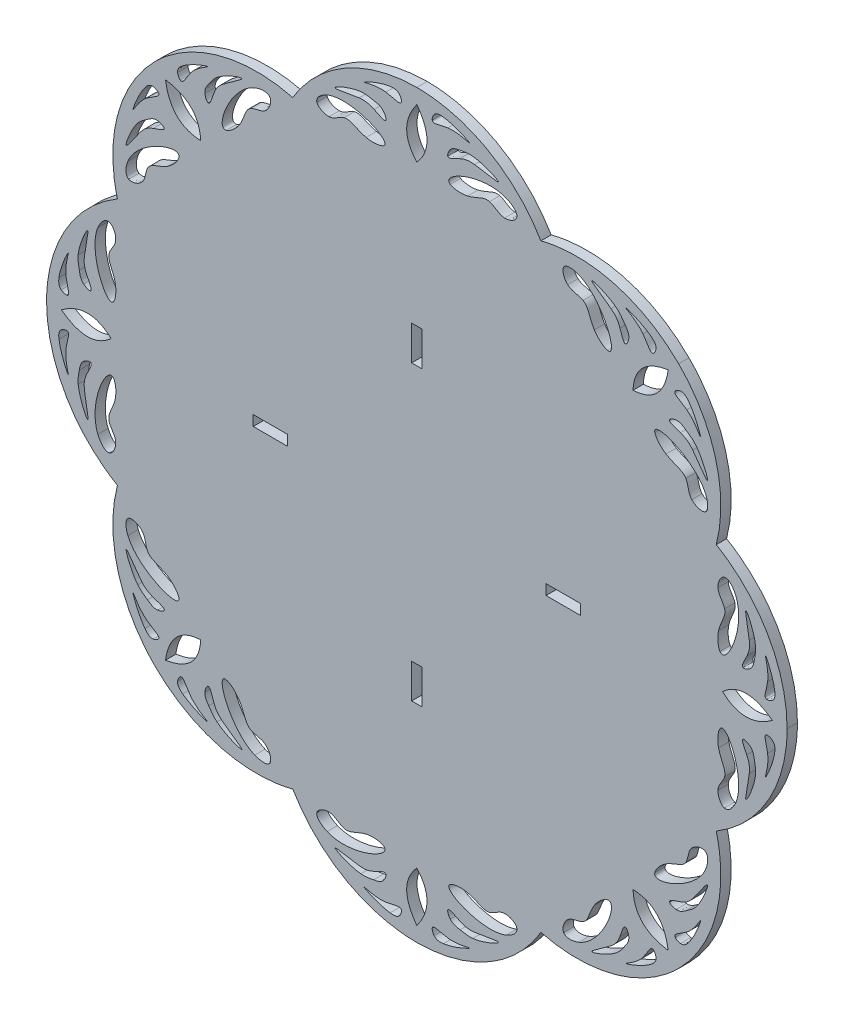
from build123d import *

# Parameters (mm, degrees)
MODEL_W                  = 6.6666
MODEL_H                  = 2
MODEL_W_2                = 2
MODEL_H_2                = 6.6667
MODEL_W_3                = 6.6667
RESSALTO_EXTRUS_O1_DEPTH = 2


with BuildPart() as part:
    # Model → Ressalto-extrusão1 (new body)
    with BuildSketch(Plane.XY):
        with BuildLine():
            add(Edge.make_bspline(
                [(57.9547, 37.0512), (66.4517, 42.0625), (71.6666, 51.1922), (71.6667, 61.0569)],
                knots=[0.055555556, 0.055555556, 0.055555556, 0.055555556, 0.111111111, 0.111111111, 0.111111111, 0.111111111], degree=3))
            add(Edge.make_bspline(
                [(71.6667, 61.0569), (71.6667, 70.9215), (66.4518, 80.0512), (57.9546, 85.0625)],
                knots=[0.111111111, 0.111111111, 0.111111111, 0.111111111, 0.166666667, 0.166666667, 0.166666667, 0.166666667], degree=3))
            add(Edge.make_bspline(
                [(57.9546, 85.0625), (60.4196, 94.6143), (57.6514, 104.7574), (50.6761, 111.7329)],
                knots=[0.166666667, 0.166666667, 0.166666667, 0.166666667, 0.222222222, 0.222222222, 0.222222222, 0.222222222], degree=3))
            add(Edge.make_bspline(
                [(50.6761, 111.7329), (43.7007, 118.7082), (33.5575, 121.4765), (24.0057, 119.0116)],
                knots=[0.222222222, 0.222222222, 0.222222222, 0.222222222, 0.277777778, 0.277777778, 0.277777778, 0.277777778], degree=3))
            add(Edge.make_bspline(
                [(24.0057, 119.0116), (18.9945, 127.5087), (9.8648, 132.7236), (0.0001, 132.7236)],
                knots=[0.277777778, 0.277777778, 0.277777778, 0.277777778, 0.333333333, 0.333333333, 0.333333333, 0.333333333], degree=3))
            add(Edge.make_bspline(
                [(0.0001, 132.7236), (-9.8647, 132.7236), (-18.9944, 127.5087), (-24.0056, 119.0116)],
                knots=[0.333333333, 0.333333333, 0.333333333, 0.333333333, 0.388888889, 0.388888889, 0.388888889, 0.388888889], degree=3))
            add(Edge.make_bspline(
                [(-24.0056, 119.0116), (-33.5573, 121.4765), (-43.7005, 118.7083), (-50.6759, 111.7329)],
                knots=[0.388888889, 0.388888889, 0.388888889, 0.388888889, 0.444444444, 0.444444444, 0.444444444, 0.444444444], degree=3))
            add(Edge.make_bspline(
                [(-50.6759, 111.7329), (-57.6513, 104.7575), (-60.4195, 94.6143), (-57.9546, 85.0625)],
                knots=[0.444444444, 0.444444444, 0.444444444, 0.444444444, 0.5, 0.5, 0.5, 0.5], degree=3))
            add(Edge.make_bspline(
                [(-57.9546, 85.0625), (-66.4517, 80.0514), (-71.6666, 70.9216), (-71.6666, 61.0569)],
                knots=[0.5, 0.5, 0.5, 0.5, 0.555555556, 0.555555556, 0.555555556, 0.555555556], degree=3))
            add(Edge.make_bspline(
                [(-71.6666, 61.0569), (-71.6666, 51.1922), (-66.4517, 42.0625), (-57.9546, 37.0513)],
                knots=[0.555555556, 0.555555556, 0.555555556, 0.555555556, 0.611111111, 0.611111111, 0.611111111, 0.611111111], degree=3))
            add(Edge.make_bspline(
                [(-57.9546, 37.0513), (-60.4195, 27.4996), (-57.6513, 17.3563), (-50.6759, 10.3809)],
                knots=[0.611111111, 0.611111111, 0.611111111, 0.611111111, 0.666666667, 0.666666667, 0.666666667, 0.666666667], degree=3))
            add(Edge.make_bspline(
                [(-50.6759, 10.3809), (-43.7005, 3.4056), (-33.5573, 0.6374), (-24.0056, 3.1023)],
                knots=[0.666666667, 0.666666667, 0.666666667, 0.666666667, 0.722222222, 0.722222222, 0.722222222, 0.722222222], degree=3))
            add(Edge.make_bspline(
                [(-24.0056, 3.1023), (-18.9944, -5.3948), (-9.8647, -10.6097), (0.0001, -10.6097)],
                knots=[0.722222222, 0.722222222, 0.722222222, 0.722222222, 0.777777778, 0.777777778, 0.777777778, 0.777777778], degree=3))
            add(Edge.make_bspline(
                [(0.0001, -10.6097), (9.8648, -10.6097), (18.9945, -5.3948), (24.0057, 3.1023)],
                knots=[0.777777778, 0.777777778, 0.777777778, 0.777777778, 0.833333333, 0.833333333, 0.833333333, 0.833333333], degree=3))
            add(Edge.make_bspline(
                [(24.0057, 3.1023), (33.5574, 0.6374), (43.7006, 3.4056), (50.676, 10.3809)],
                knots=[0.833333333, 0.833333333, 0.833333333, 0.833333333, 0.888888889, 0.888888889, 0.888888889, 0.888888889], degree=3))
            add(Edge.make_bspline(
                [(50.676, 10.3809), (57.6513, 17.3563), (60.4196, 27.4994), (57.9547, 37.0512)],
                knots=[0.888888889, 0.888888889, 0.888888889, 0.888888889, 1, 1, 1, 1], degree=3))
        make_face()
        with Locations((28.3334, 61.0569)):
            Rectangle(MODEL_W, MODEL_H, mode=Mode.SUBTRACT)
        with Locations((0.0001, 89.39025)):
            Rectangle(MODEL_W_2, MODEL_H_2, mode=Mode.SUBTRACT)
        with Locations((-28.33325, 61.0569)):
            Rectangle(MODEL_W_3, MODEL_H, mode=Mode.SUBTRACT)
        with Locations((0.0001, 32.72365)):
            Rectangle(MODEL_W_2, MODEL_H_2, mode=Mode.SUBTRACT)
        with BuildLine():
            add(Edge.make_bspline(
                [(-52.2509, 104.8151), (-51.0841, 105.7149), (-49.5495, 106.2377), (-50.0038, 106.8337)],
                knots=[0, 0, 0, 0, 0.166666667, 0.166666667, 0.166666667, 0.166666667], degree=3))
            add(Edge.make_bspline(
                [(-50.0038, 106.8337), (-50.1747, 107.0579), (-50.6271, 107.2925), (-51.0214, 107.3395)],
                knots=[0.166666667, 0.166666667, 0.166666667, 0.166666667, 0.333333333, 0.333333333, 0.333333333, 0.333333333], degree=3))
            add(Edge.make_bspline(
                [(-51.0214, 107.3395), (-51.675, 107.4175), (-52.1689, 106.9805), (-52.6361, 106.3699)],
                knots=[0.333333333, 0.333333333, 0.333333333, 0.333333333, 0.5, 0.5, 0.5, 0.5], degree=3))
            add(Edge.make_bspline(
                [(-52.6361, 106.3699), (-53.9612, 104.6382), (-55.0714, 101.5111), (-54.917, 101.5396)],
                knots=[0.5, 0.5, 0.5, 0.5, 0.666666667, 0.666666667, 0.666666667, 0.666666667], degree=3))
            add(Edge.make_bspline(
                [(-54.917, 101.5396), (-54.795, 101.5621), (-53.8823, 103.557), (-52.2509, 104.8151)],
                knots=[0.666666667, 0.666666667, 0.666666667, 0.666666667, 1, 1, 1, 1], degree=3))
        make_face(mode=Mode.SUBTRACT)
        with BuildLine():
            add(Edge.make_bspline(
                [(-52.0754, 93.2206), (-51.4239, 94.3293), (-49.6775, 94.4625), (-48.2286, 95.3916)],
                knots=[0, 0, 0, 0, 0.142857143, 0.142857143, 0.142857143, 0.142857143], degree=3))
            add(Edge.make_bspline(
                [(-48.2286, 95.3916), (-47.1296, 96.0963), (-46.2019, 97.2589), (-46.0576, 97.9434)],
                knots=[0.142857143, 0.142857143, 0.142857143, 0.142857143, 0.285714286, 0.285714286, 0.285714286, 0.285714286], degree=3))
            add(Edge.make_bspline(
                [(-46.0576, 97.9434), (-45.5709, 100.253), (-54.0055, 97.1175), (-55.9222, 92.4208)],
                knots=[0.285714286, 0.285714286, 0.285714286, 0.285714286, 0.428571429, 0.428571429, 0.428571429, 0.428571429], degree=3))
            add(Edge.make_bspline(
                [(-55.9222, 92.4208), (-56.4254, 91.1875), (-56.4794, 89.8466), (-55.7668, 89.4564)],
                knots=[0.428571429, 0.428571429, 0.428571429, 0.428571429, 0.571428571, 0.571428571, 0.571428571, 0.571428571], degree=3))
            add(Edge.make_bspline(
                [(-55.7668, 89.4564), (-55.1261, 89.1054), (-53.8656, 89.5232), (-53.218, 90.2498)],
                knots=[0.571428571, 0.571428571, 0.571428571, 0.571428571, 0.714285714, 0.714285714, 0.714285714, 0.714285714], degree=3))
            add(Edge.make_bspline(
                [(-53.218, 90.2498), (-52.4458, 91.1162), (-52.5449, 92.4217), (-52.0754, 93.2206)],
                knots=[0.714285714, 0.714285714, 0.714285714, 0.714285714, 1, 1, 1, 1], degree=3))
        make_face(mode=Mode.SUBTRACT)
        with BuildLine():
            add(Edge.make_bspline(
                [(-32.1751, 113.1209), (-31.3762, 113.5904), (-30.0707, 113.4913), (-29.2043, 114.2635)],
                knots=[0, 0, 0, 0, 0.142857143, 0.142857143, 0.142857143, 0.142857143], degree=3))
            add(Edge.make_bspline(
                [(-29.2043, 114.2635), (-28.4777, 114.9111), (-28.0598, 116.1716), (-28.4109, 116.8123)],
                knots=[0.142857143, 0.142857143, 0.142857143, 0.142857143, 0.285714286, 0.285714286, 0.285714286, 0.285714286], degree=3))
            add(Edge.make_bspline(
                [(-28.4109, 116.8123), (-28.8011, 117.5248), (-30.142, 117.4709), (-31.3753, 116.9677)],
                knots=[0.285714286, 0.285714286, 0.285714286, 0.285714286, 0.428571429, 0.428571429, 0.428571429, 0.428571429], degree=3))
            add(Edge.make_bspline(
                [(-31.3753, 116.9677), (-36.072, 115.051), (-39.2075, 106.6164), (-36.8979, 107.1032)],
                knots=[0.428571429, 0.428571429, 0.428571429, 0.428571429, 0.571428571, 0.571428571, 0.571428571, 0.571428571], degree=3))
            add(Edge.make_bspline(
                [(-36.8979, 107.1032), (-36.2135, 107.2473), (-35.0508, 108.1751), (-34.3461, 109.2741)],
                knots=[0.571428571, 0.571428571, 0.571428571, 0.571428571, 0.714285714, 0.714285714, 0.714285714, 0.714285714], degree=3))
            add(Edge.make_bspline(
                [(-34.3461, 109.2741), (-33.417, 110.7229), (-33.2838, 112.4693), (-32.1751, 113.1209)],
                knots=[0.714285714, 0.714285714, 0.714285714, 0.714285714, 1, 1, 1, 1], degree=3))
        make_face(mode=Mode.SUBTRACT)
        with BuildLine():
            add(Edge.make_bspline(
                [(-43.7696, 113.2964), (-42.5115, 114.9278), (-40.5165, 115.8405), (-40.4941, 115.9625)],
                knots=[0, 0, 0, 0, 0.166666667, 0.166666667, 0.166666667, 0.166666667], degree=3))
            add(Edge.make_bspline(
                [(-40.4941, 115.9625), (-40.4657, 116.1169), (-43.5927, 115.0068), (-45.3243, 113.6817)],
                knots=[0.166666667, 0.166666667, 0.166666667, 0.166666667, 0.333333333, 0.333333333, 0.333333333, 0.333333333], degree=3))
            add(Edge.make_bspline(
                [(-45.3243, 113.6817), (-45.9349, 113.2144), (-46.372, 112.7205), (-46.2941, 112.0669)],
                knots=[0.333333333, 0.333333333, 0.333333333, 0.333333333, 0.5, 0.5, 0.5, 0.5], degree=3))
            add(Edge.make_bspline(
                [(-46.2941, 112.0669), (-46.247, 111.6726), (-46.0124, 111.2202), (-45.7882, 111.0493)],
                knots=[0.5, 0.5, 0.5, 0.5, 0.666666667, 0.666666667, 0.666666667, 0.666666667], degree=3))
            add(Edge.make_bspline(
                [(-45.7882, 111.0493), (-45.1922, 110.595), (-44.6694, 112.1296), (-43.7696, 113.2964)],
                knots=[0.666666667, 0.666666667, 0.666666667, 0.666666667, 1, 1, 1, 1], degree=3))
        make_face(mode=Mode.SUBTRACT)
        with BuildLine():
            add(Edge.make_bspline(
                [(-65.3251, 52.6691), (-65.4687, 51.8708), (-65.6418, 51.1534), (-65.5495, 50.2005)],
                knots=[0, 0, 0, 0, 0.125, 0.125, 0.125, 0.125], degree=3))
            add(Edge.make_bspline(
                [(-65.5495, 50.2005), (-65.3525, 48.1667), (-63.9461, 45.0602), (-63.6955, 45.2451)],
                knots=[0.125, 0.125, 0.125, 0.125, 0.25, 0.25, 0.25, 0.25], degree=3))
            add(Edge.make_bspline(
                [(-63.6955, 45.2451), (-63.4739, 45.4086), (-64.1556, 48.1441), (-64.3418, 49.8773)],
                knots=[0.25, 0.25, 0.25, 0.25, 0.375, 0.375, 0.375, 0.375], degree=3))
            add(Edge.make_bspline(
                [(-64.3418, 49.8773), (-64.4592, 50.9701), (-64.3797, 51.6644), (-63.857, 52.786)],
                knots=[0.375, 0.375, 0.375, 0.375, 0.5, 0.5, 0.5, 0.5], degree=3))
            add(Edge.make_bspline(
                [(-63.857, 52.786), (-63.4373, 53.6866), (-62.7316, 54.8628), (-63.1568, 55.0482)],
                knots=[0.5, 0.5, 0.5, 0.5, 0.625, 0.625, 0.625, 0.625], degree=3))
            add(Edge.make_bspline(
                [(-63.1568, 55.0482), (-63.4115, 55.1593), (-64.0717, 54.9149), (-64.4915, 54.5685)],
                knots=[0.625, 0.625, 0.625, 0.625, 0.75, 0.75, 0.75, 0.75], degree=3))
            add(Edge.make_bspline(
                [(-64.4915, 54.5685), (-65.1055, 54.062), (-65.205, 53.3372), (-65.3251, 52.6691)],
                knots=[0.75, 0.75, 0.75, 0.75, 1, 1, 1, 1], degree=3))
        make_face(mode=Mode.SUBTRACT)
        with BuildLine():
            add(Edge.make_bspline(
                [(-65.3251, 69.4217), (-65.205, 68.7537), (-65.1055, 68.0289), (-64.4915, 67.5224)],
                knots=[0, 0, 0, 0, 0.125, 0.125, 0.125, 0.125], degree=3))
            add(Edge.make_bspline(
                [(-64.4915, 67.5224), (-64.0717, 67.176), (-63.4115, 66.9316), (-63.1568, 67.0427)],
                knots=[0.125, 0.125, 0.125, 0.125, 0.25, 0.25, 0.25, 0.25], degree=3))
            add(Edge.make_bspline(
                [(-63.1568, 67.0427), (-62.7316, 67.2281), (-63.4373, 68.4042), (-63.857, 69.3049)],
                knots=[0.25, 0.25, 0.25, 0.25, 0.375, 0.375, 0.375, 0.375], degree=3))
            add(Edge.make_bspline(
                [(-63.857, 69.3049), (-64.3797, 70.4264), (-64.4592, 71.1208), (-64.3418, 72.2135)],
                knots=[0.375, 0.375, 0.375, 0.375, 0.5, 0.5, 0.5, 0.5], degree=3))
            add(Edge.make_bspline(
                [(-64.3418, 72.2135), (-64.1556, 73.9468), (-63.4739, 76.6823), (-63.6955, 76.8458)],
                knots=[0.5, 0.5, 0.5, 0.5, 0.625, 0.625, 0.625, 0.625], degree=3))
            add(Edge.make_bspline(
                [(-63.6955, 76.8458), (-63.9461, 77.0307), (-65.3525, 73.9242), (-65.5495, 71.8904)],
                knots=[0.625, 0.625, 0.625, 0.625, 0.75, 0.75, 0.75, 0.75], degree=3))
            add(Edge.make_bspline(
                [(-65.5495, 71.8904), (-65.6418, 70.9375), (-65.4687, 70.2201), (-65.3251, 69.4217)],
                knots=[0.75, 0.75, 0.75, 0.75, 1, 1, 1, 1], degree=3))
        make_face(mode=Mode.SUBTRACT)
        with BuildLine():
            add(Edge.make_bspline(
                [(-43.7696, 8.7945), (-44.6694, 9.9613), (-45.1922, 11.4959), (-45.7882, 11.0416)],
                knots=[0, 0, 0, 0, 0.166666667, 0.166666667, 0.166666667, 0.166666667], degree=3))
            add(Edge.make_bspline(
                [(-45.7882, 11.0416), (-46.0124, 10.8707), (-46.247, 10.4182), (-46.2941, 10.0239)],
                knots=[0.166666667, 0.166666667, 0.166666667, 0.166666667, 0.333333333, 0.333333333, 0.333333333, 0.333333333], degree=3))
            add(Edge.make_bspline(
                [(-46.2941, 10.0239), (-46.372, 9.3704), (-45.9349, 8.8765), (-45.3243, 8.4092)],
                knots=[0.333333333, 0.333333333, 0.333333333, 0.333333333, 0.5, 0.5, 0.5, 0.5], degree=3))
            add(Edge.make_bspline(
                [(-45.3243, 8.4092), (-43.5927, 7.0841), (-40.4657, 5.974), (-40.4941, 6.1284)],
                knots=[0.5, 0.5, 0.5, 0.5, 0.666666667, 0.666666667, 0.666666667, 0.666666667], degree=3))
            add(Edge.make_bspline(
                [(-40.4941, 6.1284), (-40.5165, 6.2504), (-42.5115, 7.163), (-43.7696, 8.7945)],
                knots=[0.666666667, 0.666666667, 0.666666667, 0.666666667, 1, 1, 1, 1], degree=3))
        make_face(mode=Mode.SUBTRACT)
        with BuildLine():
            add(Edge.make_bspline(
                [(-32.1751, 8.97), (-33.2838, 9.6215), (-33.417, 11.368), (-34.3461, 12.8168)],
                knots=[0, 0, 0, 0, 0.142857143, 0.142857143, 0.142857143, 0.142857143], degree=3))
            add(Edge.make_bspline(
                [(-34.3461, 12.8168), (-35.0508, 13.9158), (-36.2135, 14.8436), (-36.8979, 14.9877)],
                knots=[0.142857143, 0.142857143, 0.142857143, 0.142857143, 0.285714286, 0.285714286, 0.285714286, 0.285714286], degree=3))
            add(Edge.make_bspline(
                [(-36.8979, 14.9877), (-39.2075, 15.4745), (-36.072, 7.0399), (-31.3753, 5.1232)],
                knots=[0.285714286, 0.285714286, 0.285714286, 0.285714286, 0.428571429, 0.428571429, 0.428571429, 0.428571429], degree=3))
            add(Edge.make_bspline(
                [(-31.3753, 5.1232), (-30.142, 4.6199), (-28.8011, 4.5661), (-28.4109, 5.2785)],
                knots=[0.428571429, 0.428571429, 0.428571429, 0.428571429, 0.571428571, 0.571428571, 0.571428571, 0.571428571], degree=3))
            add(Edge.make_bspline(
                [(-28.4109, 5.2785), (-28.0598, 5.9193), (-28.4777, 7.1798), (-29.2043, 7.8274)],
                knots=[0.571428571, 0.571428571, 0.571428571, 0.571428571, 0.714285714, 0.714285714, 0.714285714, 0.714285714], degree=3))
            add(Edge.make_bspline(
                [(-29.2043, 7.8274), (-30.0707, 8.5996), (-31.3762, 8.5005), (-32.1751, 8.97)],
                knots=[0.714285714, 0.714285714, 0.714285714, 0.714285714, 1, 1, 1, 1], degree=3))
        make_face(mode=Mode.SUBTRACT)
        with BuildLine():
            add(Edge.make_bspline(
                [(-52.0754, 28.8702), (-52.5449, 29.6692), (-52.4458, 30.9747), (-53.218, 31.8411)],
                knots=[0, 0, 0, 0, 0.142857143, 0.142857143, 0.142857143, 0.142857143], degree=3))
            add(Edge.make_bspline(
                [(-53.218, 31.8411), (-53.8656, 32.5677), (-55.1261, 32.9855), (-55.7668, 32.6345)],
                knots=[0.142857143, 0.142857143, 0.142857143, 0.142857143, 0.285714286, 0.285714286, 0.285714286, 0.285714286], degree=3))
            add(Edge.make_bspline(
                [(-55.7668, 32.6345), (-56.4794, 32.2443), (-56.4254, 30.9034), (-55.9222, 29.6701)],
                knots=[0.285714286, 0.285714286, 0.285714286, 0.285714286, 0.428571429, 0.428571429, 0.428571429, 0.428571429], degree=3))
            add(Edge.make_bspline(
                [(-55.9222, 29.6701), (-54.0055, 24.9733), (-45.5709, 21.8379), (-46.0576, 24.1474)],
                knots=[0.428571429, 0.428571429, 0.428571429, 0.428571429, 0.571428571, 0.571428571, 0.571428571, 0.571428571], degree=3))
            add(Edge.make_bspline(
                [(-46.0576, 24.1474), (-46.2019, 24.8319), (-47.1296, 25.9946), (-48.2286, 26.6993)],
                knots=[0.571428571, 0.571428571, 0.571428571, 0.571428571, 0.714285714, 0.714285714, 0.714285714, 0.714285714], degree=3))
            add(Edge.make_bspline(
                [(-48.2286, 26.6993), (-49.6775, 27.6284), (-51.4239, 27.7616), (-52.0754, 28.8702)],
                knots=[0.714285714, 0.714285714, 0.714285714, 0.714285714, 1, 1, 1, 1], degree=3))
        make_face(mode=Mode.SUBTRACT)
        with BuildLine():
            add(Edge.make_bspline(
                [(-52.2509, 17.2758), (-53.8823, 18.5339), (-54.795, 20.5288), (-54.917, 20.5513)],
                knots=[0, 0, 0, 0, 0.166666667, 0.166666667, 0.166666667, 0.166666667], degree=3))
            add(Edge.make_bspline(
                [(-54.917, 20.5513), (-55.0714, 20.5797), (-53.9612, 17.4526), (-52.6361, 15.721)],
                knots=[0.166666667, 0.166666667, 0.166666667, 0.166666667, 0.333333333, 0.333333333, 0.333333333, 0.333333333], degree=3))
            add(Edge.make_bspline(
                [(-52.6361, 15.721), (-52.1689, 15.1104), (-51.675, 14.6734), (-51.0214, 14.7514)],
                knots=[0.333333333, 0.333333333, 0.333333333, 0.333333333, 0.5, 0.5, 0.5, 0.5], degree=3))
            add(Edge.make_bspline(
                [(-51.0214, 14.7514), (-50.6271, 14.7984), (-50.1747, 15.033), (-50.0038, 15.2572)],
                knots=[0.5, 0.5, 0.5, 0.5, 0.666666667, 0.666666667, 0.666666667, 0.666666667], degree=3))
            add(Edge.make_bspline(
                [(-50.0038, 15.2572), (-49.5495, 15.8531), (-51.0841, 16.376), (-52.2509, 17.2758)],
                knots=[0.666666667, 0.666666667, 0.666666667, 0.666666667, 1, 1, 1, 1], degree=3))
        make_face(mode=Mode.SUBTRACT)
        with BuildLine():
            add(Edge.make_bspline(
                [(8.3763, -4.2797), (9.1747, -4.4233), (9.8921, -4.5965), (10.845, -4.5042)],
                knots=[0, 0, 0, 0, 0.125, 0.125, 0.125, 0.125], degree=3))
            add(Edge.make_bspline(
                [(10.845, -4.5042), (12.8788, -4.3071), (15.9853, -2.9007), (15.8004, -2.65)],
                knots=[0.125, 0.125, 0.125, 0.125, 0.25, 0.25, 0.25, 0.25], degree=3))
            add(Edge.make_bspline(
                [(15.8004, -2.65), (15.6369, -2.4285), (12.9014, -3.1101), (11.1681, -3.2964)],
                knots=[0.25, 0.25, 0.25, 0.25, 0.375, 0.375, 0.375, 0.375], degree=3))
            add(Edge.make_bspline(
                [(11.1681, -3.2964), (10.0754, -3.4138), (9.3811, -3.3343), (8.2595, -2.8117)],
                knots=[0.375, 0.375, 0.375, 0.375, 0.5, 0.5, 0.5, 0.5], degree=3))
            add(Edge.make_bspline(
                [(8.2595, -2.8117), (7.3588, -2.3919), (6.1826, -1.6862), (5.9973, -2.1114)],
                knots=[0.5, 0.5, 0.5, 0.5, 0.625, 0.625, 0.625, 0.625], degree=3))
            add(Edge.make_bspline(
                [(5.9973, -2.1114), (5.8862, -2.3661), (6.1306, -3.0264), (6.477, -3.4461)],
                knots=[0.625, 0.625, 0.625, 0.625, 0.75, 0.75, 0.75, 0.75], degree=3))
            add(Edge.make_bspline(
                [(6.477, -3.4461), (6.9835, -4.0601), (7.7083, -4.1595), (8.3763, -4.2797)],
                knots=[0.75, 0.75, 0.75, 0.75, 1, 1, 1, 1], degree=3))
        make_face(mode=Mode.SUBTRACT)
        with BuildLine():
            add(Edge.make_bspline(
                [(-8.3762, -4.2797), (-7.7082, -4.1595), (-6.9834, -4.0601), (-6.4769, -3.4461)],
                knots=[0, 0, 0, 0, 0.125, 0.125, 0.125, 0.125], degree=3))
            add(Edge.make_bspline(
                [(-6.4769, -3.4461), (-6.1305, -3.0264), (-5.8861, -2.3661), (-5.9972, -2.1114)],
                knots=[0.125, 0.125, 0.125, 0.125, 0.25, 0.25, 0.25, 0.25], degree=3))
            add(Edge.make_bspline(
                [(-5.9972, -2.1114), (-6.1826, -1.6862), (-7.3587, -2.3919), (-8.2594, -2.8117)],
                knots=[0.25, 0.25, 0.25, 0.25, 0.375, 0.375, 0.375, 0.375], degree=3))
            add(Edge.make_bspline(
                [(-8.2594, -2.8117), (-9.3809, -3.3343), (-10.0753, -3.4138), (-11.1681, -3.2964)],
                knots=[0.375, 0.375, 0.375, 0.375, 0.5, 0.5, 0.5, 0.5], degree=3))
            add(Edge.make_bspline(
                [(-11.1681, -3.2964), (-12.9013, -3.1101), (-15.6368, -2.4285), (-15.8003, -2.65)],
                knots=[0.5, 0.5, 0.5, 0.5, 0.625, 0.625, 0.625, 0.625], degree=3))
            add(Edge.make_bspline(
                [(-15.8003, -2.65), (-15.9852, -2.9007), (-12.8787, -4.3071), (-10.8449, -4.5042)],
                knots=[0.625, 0.625, 0.625, 0.625, 0.75, 0.75, 0.75, 0.75], degree=3))
            add(Edge.make_bspline(
                [(-10.8449, -4.5042), (-9.892, -4.5965), (-9.1746, -4.4233), (-8.3762, -4.2797)],
                knots=[0.75, 0.75, 0.75, 0.75, 1, 1, 1, 1], degree=3))
        make_face(mode=Mode.SUBTRACT)
        with BuildLine():
            add(Edge.make_bspline(
                [(52.251, 17.2758), (51.0842, 16.376), (49.5496, 15.8531), (50.0039, 15.2572)],
                knots=[0, 0, 0, 0, 0.166666667, 0.166666667, 0.166666667, 0.166666667], degree=3))
            add(Edge.make_bspline(
                [(50.0039, 15.2572), (50.1748, 15.033), (50.6272, 14.7984), (51.0215, 14.7514)],
                knots=[0.166666667, 0.166666667, 0.166666667, 0.166666667, 0.333333333, 0.333333333, 0.333333333, 0.333333333], degree=3))
            add(Edge.make_bspline(
                [(51.0215, 14.7514), (51.6751, 14.6734), (52.169, 15.1104), (52.6362, 15.721)],
                knots=[0.333333333, 0.333333333, 0.333333333, 0.333333333, 0.5, 0.5, 0.5, 0.5], degree=3))
            add(Edge.make_bspline(
                [(52.6362, 15.721), (53.9613, 17.4526), (55.0715, 20.5797), (54.9171, 20.5513)],
                knots=[0.5, 0.5, 0.5, 0.5, 0.666666667, 0.666666667, 0.666666667, 0.666666667], degree=3))
            add(Edge.make_bspline(
                [(54.9171, 20.5513), (54.7951, 20.5288), (53.8825, 18.5339), (52.251, 17.2758)],
                knots=[0.666666667, 0.666666667, 0.666666667, 0.666666667, 1, 1, 1, 1], degree=3))
        make_face(mode=Mode.SUBTRACT)
        with BuildLine():
            add(Edge.make_bspline(
                [(52.0755, 28.8702), (51.424, 27.7616), (49.6776, 27.6284), (48.2287, 26.6993)],
                knots=[0, 0, 0, 0, 0.142857143, 0.142857143, 0.142857143, 0.142857143], degree=3))
            add(Edge.make_bspline(
                [(48.2287, 26.6993), (47.1297, 25.9946), (46.202, 24.8319), (46.0577, 24.1474)],
                knots=[0.142857143, 0.142857143, 0.142857143, 0.142857143, 0.285714286, 0.285714286, 0.285714286, 0.285714286], degree=3))
            add(Edge.make_bspline(
                [(46.0577, 24.1474), (45.571, 21.8379), (54.0056, 24.9733), (55.9223, 29.6701)],
                knots=[0.285714286, 0.285714286, 0.285714286, 0.285714286, 0.428571429, 0.428571429, 0.428571429, 0.428571429], degree=3))
            add(Edge.make_bspline(
                [(55.9223, 29.6701), (56.4256, 30.9034), (56.4795, 32.2443), (55.7669, 32.6345)],
                knots=[0.428571429, 0.428571429, 0.428571429, 0.428571429, 0.571428571, 0.571428571, 0.571428571, 0.571428571], degree=3))
            add(Edge.make_bspline(
                [(55.7669, 32.6345), (55.1262, 32.9855), (53.8657, 32.5677), (53.2181, 31.8411)],
                knots=[0.571428571, 0.571428571, 0.571428571, 0.571428571, 0.714285714, 0.714285714, 0.714285714, 0.714285714], degree=3))
            add(Edge.make_bspline(
                [(53.2181, 31.8411), (52.4459, 30.9747), (52.545, 29.6692), (52.0755, 28.8702)],
                knots=[0.714285714, 0.714285714, 0.714285714, 0.714285714, 1, 1, 1, 1], degree=3))
        make_face(mode=Mode.SUBTRACT)
        with BuildLine():
            add(Edge.make_bspline(
                [(32.1752, 8.97), (31.3763, 8.5005), (30.0709, 8.5996), (29.2044, 7.8274)],
                knots=[0, 0, 0, 0, 0.142857143, 0.142857143, 0.142857143, 0.142857143], degree=3))
            add(Edge.make_bspline(
                [(29.2044, 7.8274), (28.4778, 7.1798), (28.0599, 5.9193), (28.4109, 5.2785)],
                knots=[0.142857143, 0.142857143, 0.142857143, 0.142857143, 0.285714286, 0.285714286, 0.285714286, 0.285714286], degree=3))
            add(Edge.make_bspline(
                [(28.4109, 5.2785), (28.8012, 4.5661), (30.1421, 4.6199), (31.3754, 5.1232)],
                knots=[0.285714286, 0.285714286, 0.285714286, 0.285714286, 0.428571429, 0.428571429, 0.428571429, 0.428571429], degree=3))
            add(Edge.make_bspline(
                [(31.3754, 5.1232), (36.0721, 7.0399), (39.2076, 15.4745), (36.898, 14.9877)],
                knots=[0.428571429, 0.428571429, 0.428571429, 0.428571429, 0.571428571, 0.571428571, 0.571428571, 0.571428571], degree=3))
            add(Edge.make_bspline(
                [(36.898, 14.9877), (36.2136, 14.8436), (35.0509, 13.9158), (34.3462, 12.8168)],
                knots=[0.571428571, 0.571428571, 0.571428571, 0.571428571, 0.714285714, 0.714285714, 0.714285714, 0.714285714], degree=3))
            add(Edge.make_bspline(
                [(34.3462, 12.8168), (33.417, 11.368), (33.2839, 9.6215), (32.1752, 8.97)],
                knots=[0.714285714, 0.714285714, 0.714285714, 0.714285714, 1, 1, 1, 1], degree=3))
        make_face(mode=Mode.SUBTRACT)
        with BuildLine():
            add(Edge.make_bspline(
                [(43.7697, 8.7945), (42.5116, 7.163), (40.5166, 6.2504), (40.4942, 6.1284)],
                knots=[0, 0, 0, 0, 0.166666667, 0.166666667, 0.166666667, 0.166666667], degree=3))
            add(Edge.make_bspline(
                [(40.4942, 6.1284), (40.4658, 5.974), (43.5928, 7.0841), (45.3244, 8.4092)],
                knots=[0.166666667, 0.166666667, 0.166666667, 0.166666667, 0.333333333, 0.333333333, 0.333333333, 0.333333333], degree=3))
            add(Edge.make_bspline(
                [(45.3244, 8.4092), (45.935, 8.8765), (46.3721, 9.3704), (46.2941, 10.0239)],
                knots=[0.333333333, 0.333333333, 0.333333333, 0.333333333, 0.5, 0.5, 0.5, 0.5], degree=3))
            add(Edge.make_bspline(
                [(46.2941, 10.0239), (46.2471, 10.4182), (46.0125, 10.8707), (45.7883, 11.0416)],
                knots=[0.5, 0.5, 0.5, 0.5, 0.666666667, 0.666666667, 0.666666667, 0.666666667], degree=3))
            add(Edge.make_bspline(
                [(45.7883, 11.0416), (45.1923, 11.4959), (44.6694, 9.9613), (43.7697, 8.7945)],
                knots=[0.666666667, 0.666666667, 0.666666667, 0.666666667, 1, 1, 1, 1], degree=3))
        make_face(mode=Mode.SUBTRACT)
        with BuildLine():
            add(Edge.make_bspline(
                [(65.3252, 69.4217), (65.4688, 70.2201), (65.6419, 70.9375), (65.5496, 71.8904)],
                knots=[0, 0, 0, 0, 0.125, 0.125, 0.125, 0.125], degree=3))
            add(Edge.make_bspline(
                [(65.5496, 71.8904), (65.3526, 73.9242), (63.9462, 77.0307), (63.6955, 76.8458)],
                knots=[0.125, 0.125, 0.125, 0.125, 0.25, 0.25, 0.25, 0.25], degree=3))
            add(Edge.make_bspline(
                [(63.6955, 76.8458), (63.474, 76.6823), (64.1556, 73.9468), (64.3419, 72.2135)],
                knots=[0.25, 0.25, 0.25, 0.25, 0.375, 0.375, 0.375, 0.375], degree=3))
            add(Edge.make_bspline(
                [(64.3419, 72.2135), (64.4593, 71.1208), (64.3798, 70.4264), (63.8571, 69.3049)],
                knots=[0.375, 0.375, 0.375, 0.375, 0.5, 0.5, 0.5, 0.5], degree=3))
            add(Edge.make_bspline(
                [(63.8571, 69.3049), (63.4373, 68.4042), (62.7317, 67.2281), (63.1569, 67.0427)],
                knots=[0.5, 0.5, 0.5, 0.5, 0.625, 0.625, 0.625, 0.625], degree=3))
            add(Edge.make_bspline(
                [(63.1569, 67.0427), (63.4116, 66.9316), (64.0718, 67.176), (64.4916, 67.5224)],
                knots=[0.625, 0.625, 0.625, 0.625, 0.75, 0.75, 0.75, 0.75], degree=3))
            add(Edge.make_bspline(
                [(64.4916, 67.5224), (65.1055, 68.0289), (65.2051, 68.7537), (65.3252, 69.4217)],
                knots=[0.75, 0.75, 0.75, 0.75, 1, 1, 1, 1], degree=3))
        make_face(mode=Mode.SUBTRACT)
        with BuildLine():
            add(Edge.make_bspline(
                [(65.3252, 52.6691), (65.2051, 53.3372), (65.1055, 54.062), (64.4916, 54.5685)],
                knots=[0, 0, 0, 0, 0.125, 0.125, 0.125, 0.125], degree=3))
            add(Edge.make_bspline(
                [(64.4916, 54.5685), (64.0718, 54.9149), (63.4116, 55.1593), (63.1569, 55.0482)],
                knots=[0.125, 0.125, 0.125, 0.125, 0.25, 0.25, 0.25, 0.25], degree=3))
            add(Edge.make_bspline(
                [(63.1569, 55.0482), (62.7317, 54.8628), (63.4373, 53.6866), (63.8571, 52.786)],
                knots=[0.25, 0.25, 0.25, 0.25, 0.375, 0.375, 0.375, 0.375], degree=3))
            add(Edge.make_bspline(
                [(63.8571, 52.786), (64.3798, 51.6644), (64.4593, 50.9701), (64.3419, 49.8773)],
                knots=[0.375, 0.375, 0.375, 0.375, 0.5, 0.5, 0.5, 0.5], degree=3))
            add(Edge.make_bspline(
                [(64.3419, 49.8773), (64.1556, 48.1441), (63.474, 45.4086), (63.6955, 45.2451)],
                knots=[0.5, 0.5, 0.5, 0.5, 0.625, 0.625, 0.625, 0.625], degree=3))
            add(Edge.make_bspline(
                [(63.6955, 45.2451), (63.9462, 45.0602), (65.3526, 48.1667), (65.5496, 50.2005)],
                knots=[0.625, 0.625, 0.625, 0.625, 0.75, 0.75, 0.75, 0.75], degree=3))
            add(Edge.make_bspline(
                [(65.5496, 50.2005), (65.6419, 51.1534), (65.4688, 51.8708), (65.3252, 52.6691)],
                knots=[0.75, 0.75, 0.75, 0.75, 1, 1, 1, 1], degree=3))
        make_face(mode=Mode.SUBTRACT)
        with BuildLine():
            add(Edge.make_bspline(
                [(43.7697, 113.2964), (44.6694, 112.1296), (45.1923, 110.595), (45.7883, 111.0493)],
                knots=[0, 0, 0, 0, 0.166666667, 0.166666667, 0.166666667, 0.166666667], degree=3))
            add(Edge.make_bspline(
                [(45.7883, 111.0493), (46.0125, 111.2202), (46.2471, 111.6726), (46.2941, 112.0669)],
                knots=[0.166666667, 0.166666667, 0.166666667, 0.166666667, 0.333333333, 0.333333333, 0.333333333, 0.333333333], degree=3))
            add(Edge.make_bspline(
                [(46.2941, 112.0669), (46.3721, 112.7205), (45.935, 113.2144), (45.3244, 113.6817)],
                knots=[0.333333333, 0.333333333, 0.333333333, 0.333333333, 0.5, 0.5, 0.5, 0.5], degree=3))
            add(Edge.make_bspline(
                [(45.3244, 113.6817), (43.5928, 115.0068), (40.4658, 116.1169), (40.4942, 115.9625)],
                knots=[0.5, 0.5, 0.5, 0.5, 0.666666667, 0.666666667, 0.666666667, 0.666666667], degree=3))
            add(Edge.make_bspline(
                [(40.4942, 115.9625), (40.5166, 115.8405), (42.5116, 114.9278), (43.7697, 113.2964)],
                knots=[0.666666667, 0.666666667, 0.666666667, 0.666666667, 1, 1, 1, 1], degree=3))
        make_face(mode=Mode.SUBTRACT)
        with BuildLine():
            add(Edge.make_bspline(
                [(32.1752, 113.1209), (33.2839, 112.4693), (33.417, 110.7229), (34.3462, 109.2741)],
                knots=[0, 0, 0, 0, 0.142857143, 0.142857143, 0.142857143, 0.142857143], degree=3))
            add(Edge.make_bspline(
                [(34.3462, 109.2741), (35.0509, 108.1751), (36.2136, 107.2473), (36.898, 107.1032)],
                knots=[0.142857143, 0.142857143, 0.142857143, 0.142857143, 0.285714286, 0.285714286, 0.285714286, 0.285714286], degree=3))
            add(Edge.make_bspline(
                [(36.898, 107.1032), (39.2076, 106.6164), (36.0721, 115.051), (31.3754, 116.9677)],
                knots=[0.285714286, 0.285714286, 0.285714286, 0.285714286, 0.428571429, 0.428571429, 0.428571429, 0.428571429], degree=3))
            add(Edge.make_bspline(
                [(31.3754, 116.9677), (30.1421, 117.4709), (28.8012, 117.5248), (28.4109, 116.8123)],
                knots=[0.428571429, 0.428571429, 0.428571429, 0.428571429, 0.571428571, 0.571428571, 0.571428571, 0.571428571], degree=3))
            add(Edge.make_bspline(
                [(28.4109, 116.8123), (28.0599, 116.1716), (28.4778, 114.9111), (29.2044, 114.2635)],
                knots=[0.571428571, 0.571428571, 0.571428571, 0.571428571, 0.714285714, 0.714285714, 0.714285714, 0.714285714], degree=3))
            add(Edge.make_bspline(
                [(29.2044, 114.2635), (30.0709, 113.4913), (31.3763, 113.5904), (32.1752, 113.1209)],
                knots=[0.714285714, 0.714285714, 0.714285714, 0.714285714, 1, 1, 1, 1], degree=3))
        make_face(mode=Mode.SUBTRACT)
        with BuildLine():
            add(Edge.make_bspline(
                [(52.0755, 93.2206), (52.545, 92.4217), (52.4459, 91.1162), (53.2181, 90.2498)],
                knots=[0, 0, 0, 0, 0.142857143, 0.142857143, 0.142857143, 0.142857143], degree=3))
            add(Edge.make_bspline(
                [(53.2181, 90.2498), (53.8657, 89.5232), (55.1262, 89.1054), (55.7669, 89.4564)],
                knots=[0.142857143, 0.142857143, 0.142857143, 0.142857143, 0.285714286, 0.285714286, 0.285714286, 0.285714286], degree=3))
            add(Edge.make_bspline(
                [(55.7669, 89.4564), (56.4795, 89.8466), (56.4256, 91.1875), (55.9223, 92.4208)],
                knots=[0.285714286, 0.285714286, 0.285714286, 0.285714286, 0.428571429, 0.428571429, 0.428571429, 0.428571429], degree=3))
            add(Edge.make_bspline(
                [(55.9223, 92.4208), (54.0056, 97.1175), (45.571, 100.253), (46.0577, 97.9434)],
                knots=[0.428571429, 0.428571429, 0.428571429, 0.428571429, 0.571428571, 0.571428571, 0.571428571, 0.571428571], degree=3))
            add(Edge.make_bspline(
                [(46.0577, 97.9434), (46.202, 97.2589), (47.1297, 96.0963), (48.2287, 95.3916)],
                knots=[0.571428571, 0.571428571, 0.571428571, 0.571428571, 0.714285714, 0.714285714, 0.714285714, 0.714285714], degree=3))
            add(Edge.make_bspline(
                [(48.2287, 95.3916), (49.6776, 94.4625), (51.424, 94.3293), (52.0755, 93.2206)],
                knots=[0.714285714, 0.714285714, 0.714285714, 0.714285714, 1, 1, 1, 1], degree=3))
        make_face(mode=Mode.SUBTRACT)
        with BuildLine():
            add(Edge.make_bspline(
                [(52.251, 104.8151), (53.8825, 103.557), (54.7951, 101.5621), (54.9171, 101.5396)],
                knots=[0, 0, 0, 0, 0.166666667, 0.166666667, 0.166666667, 0.166666667], degree=3))
            add(Edge.make_bspline(
                [(54.9171, 101.5396), (55.0715, 101.5111), (53.9613, 104.6382), (52.6362, 106.3699)],
                knots=[0.166666667, 0.166666667, 0.166666667, 0.166666667, 0.333333333, 0.333333333, 0.333333333, 0.333333333], degree=3))
            add(Edge.make_bspline(
                [(52.6362, 106.3699), (52.169, 106.9805), (51.6751, 107.4175), (51.0215, 107.3395)],
                knots=[0.333333333, 0.333333333, 0.333333333, 0.333333333, 0.5, 0.5, 0.5, 0.5], degree=3))
            add(Edge.make_bspline(
                [(51.0215, 107.3395), (50.6272, 107.2925), (50.1748, 107.0579), (50.0039, 106.8337)],
                knots=[0.5, 0.5, 0.5, 0.5, 0.666666667, 0.666666667, 0.666666667, 0.666666667], degree=3))
            add(Edge.make_bspline(
                [(50.0039, 106.8337), (49.5496, 106.2377), (51.0842, 105.7149), (52.251, 104.8151)],
                knots=[0.666666667, 0.666666667, 0.666666667, 0.666666667, 1, 1, 1, 1], degree=3))
        make_face(mode=Mode.SUBTRACT)
        with BuildLine():
            add(Edge.make_bspline(
                [(-8.3762, 126.3706), (-9.1746, 126.5142), (-9.892, 126.6873), (-10.8449, 126.5951)],
                knots=[0, 0, 0, 0, 0.125, 0.125, 0.125, 0.125], degree=3))
            add(Edge.make_bspline(
                [(-10.8449, 126.5951), (-12.8787, 126.398), (-15.9852, 124.9916), (-15.8003, 124.7409)],
                knots=[0.125, 0.125, 0.125, 0.125, 0.25, 0.25, 0.25, 0.25], degree=3))
            add(Edge.make_bspline(
                [(-15.8003, 124.7409), (-15.6368, 124.5194), (-12.9013, 125.201), (-11.1681, 125.3873)],
                knots=[0.25, 0.25, 0.25, 0.25, 0.375, 0.375, 0.375, 0.375], degree=3))
            add(Edge.make_bspline(
                [(-11.1681, 125.3873), (-10.0753, 125.5047), (-9.3809, 125.4252), (-8.2594, 124.9025)],
                knots=[0.375, 0.375, 0.375, 0.375, 0.5, 0.5, 0.5, 0.5], degree=3))
            add(Edge.make_bspline(
                [(-8.2594, 124.9025), (-7.3587, 124.4828), (-6.1826, 123.7771), (-5.9972, 124.2023)],
                knots=[0.5, 0.5, 0.5, 0.5, 0.625, 0.625, 0.625, 0.625], degree=3))
            add(Edge.make_bspline(
                [(-5.9972, 124.2023), (-5.8861, 124.457), (-6.1305, 125.1173), (-6.4769, 125.537)],
                knots=[0.625, 0.625, 0.625, 0.625, 0.75, 0.75, 0.75, 0.75], degree=3))
            add(Edge.make_bspline(
                [(-6.4769, 125.537), (-6.9834, 126.151), (-7.7082, 126.2504), (-8.3762, 126.3706)],
                knots=[0.75, 0.75, 0.75, 0.75, 1, 1, 1, 1], degree=3))
        make_face(mode=Mode.SUBTRACT)
        with BuildLine():
            add(Edge.make_bspline(
                [(8.3763, 126.3706), (7.7083, 126.2504), (6.9835, 126.151), (6.477, 125.537)],
                knots=[0, 0, 0, 0, 0.125, 0.125, 0.125, 0.125], degree=3))
            add(Edge.make_bspline(
                [(6.477, 125.537), (6.1306, 125.1173), (5.8862, 124.457), (5.9973, 124.2023)],
                knots=[0.125, 0.125, 0.125, 0.125, 0.25, 0.25, 0.25, 0.25], degree=3))
            add(Edge.make_bspline(
                [(5.9973, 124.2023), (6.1826, 123.7771), (7.3588, 124.4828), (8.2595, 124.9025)],
                knots=[0.25, 0.25, 0.25, 0.25, 0.375, 0.375, 0.375, 0.375], degree=3))
            add(Edge.make_bspline(
                [(8.2595, 124.9025), (9.3811, 125.4252), (10.0754, 125.5047), (11.1681, 125.3873)],
                knots=[0.375, 0.375, 0.375, 0.375, 0.5, 0.5, 0.5, 0.5], degree=3))
            add(Edge.make_bspline(
                [(11.1681, 125.3873), (12.9014, 125.201), (15.6369, 124.5194), (15.8004, 124.7409)],
                knots=[0.5, 0.5, 0.5, 0.5, 0.625, 0.625, 0.625, 0.625], degree=3))
            add(Edge.make_bspline(
                [(15.8004, 124.7409), (15.9853, 124.9916), (12.8788, 126.398), (10.845, 126.5951)],
                knots=[0.625, 0.625, 0.625, 0.625, 0.75, 0.75, 0.75, 0.75], degree=3))
            add(Edge.make_bspline(
                [(10.845, 126.5951), (9.8921, 126.6873), (9.1747, 126.5142), (8.3763, 126.3706)],
                knots=[0.75, 0.75, 0.75, 0.75, 1, 1, 1, 1], degree=3))
        make_face(mode=Mode.SUBTRACT)
        with BuildLine():
            add(Edge.make_bspline(
                [(5.9973, 128.9422), (8.0405, 129.2063), (10.0964, 128.4409), (10.1986, 128.5114)],
                knots=[0, 0, 0, 0, 0.166666667, 0.166666667, 0.166666667, 0.166666667], degree=3))
            add(Edge.make_bspline(
                [(10.1986, 128.5114), (10.3278, 128.6004), (7.3317, 130.0266), (5.1703, 130.3141)],
                knots=[0.166666667, 0.166666667, 0.166666667, 0.166666667, 0.333333333, 0.333333333, 0.333333333, 0.333333333], degree=3))
            add(Edge.make_bspline(
                [(5.1703, 130.3141), (4.4081, 130.4154), (3.7498, 130.3752), (3.3428, 129.8579)],
                knots=[0.333333333, 0.333333333, 0.333333333, 0.333333333, 0.5, 0.5, 0.5, 0.5], degree=3))
            add(Edge.make_bspline(
                [(3.3428, 129.8579), (3.0973, 129.5458), (2.9432, 129.0601), (2.9809, 128.7807)],
                knots=[0.5, 0.5, 0.5, 0.5, 0.666666667, 0.666666667, 0.666666667, 0.666666667], degree=3))
            add(Edge.make_bspline(
                [(2.9809, 128.7807), (3.0812, 128.038), (4.536, 128.7534), (5.9973, 128.9422)],
                knots=[0.666666667, 0.666666667, 0.666666667, 0.666666667, 1, 1, 1, 1], degree=3))
        make_face(mode=Mode.SUBTRACT)
        with BuildLine():
            add(Edge.make_bspline(
                [(14.0716, 120.6196), (14.9685, 120.3867), (15.8216, 119.3935), (16.9803, 119.3269)],
                knots=[0, 0, 0, 0, 0.142857143, 0.142857143, 0.142857143, 0.142857143], degree=3))
            add(Edge.make_bspline(
                [(16.9803, 119.3269), (17.952, 119.271), (19.1388, 119.8669), (19.3437, 120.5681)],
                knots=[0.142857143, 0.142857143, 0.142857143, 0.142857143, 0.285714286, 0.285714286, 0.285714286, 0.285714286], degree=3))
            add(Edge.make_bspline(
                [(19.3437, 120.5681), (19.5715, 121.3479), (18.5852, 122.2579), (17.3573, 122.7742)],
                knots=[0.285714286, 0.285714286, 0.285714286, 0.285714286, 0.428571429, 0.428571429, 0.428571429, 0.428571429], degree=3))
            add(Edge.make_bspline(
                [(17.3573, 122.7742), (12.6809, 124.7399), (4.4997, 120.9929), (6.477, 119.704)],
                knots=[0.428571429, 0.428571429, 0.428571429, 0.428571429, 0.571428571, 0.571428571, 0.571428571, 0.571428571], degree=3))
            add(Edge.make_bspline(
                [(6.477, 119.704), (7.0629, 119.322), (8.5411, 119.1558), (9.8165, 119.4346)],
                knots=[0.571428571, 0.571428571, 0.571428571, 0.571428571, 0.714285714, 0.714285714, 0.714285714, 0.714285714], degree=3))
            add(Edge.make_bspline(
                [(9.8165, 119.4346), (11.498, 119.8022), (12.827, 120.9429), (14.0716, 120.6196)],
                knots=[0.714285714, 0.714285714, 0.714285714, 0.714285714, 1, 1, 1, 1], degree=3))
        make_face(mode=Mode.SUBTRACT)
        with BuildLine():
            add(Edge.make_bspline(
                [(-14.0715, 120.6196), (-12.8269, 120.9429), (-11.4979, 119.8022), (-9.8164, 119.4346)],
                knots=[0, 0, 0, 0, 0.142857143, 0.142857143, 0.142857143, 0.142857143], degree=3))
            add(Edge.make_bspline(
                [(-9.8164, 119.4346), (-8.541, 119.1558), (-7.0628, 119.322), (-6.4769, 119.704)],
                knots=[0.142857143, 0.142857143, 0.142857143, 0.142857143, 0.285714286, 0.285714286, 0.285714286, 0.285714286], degree=3))
            add(Edge.make_bspline(
                [(-6.4769, 119.704), (-4.4996, 120.9929), (-12.6808, 124.7399), (-17.3572, 122.7742)],
                knots=[0.285714286, 0.285714286, 0.285714286, 0.285714286, 0.428571429, 0.428571429, 0.428571429, 0.428571429], degree=3))
            add(Edge.make_bspline(
                [(-17.3572, 122.7742), (-18.5851, 122.2579), (-19.5714, 121.3479), (-19.3436, 120.5681)],
                knots=[0.428571429, 0.428571429, 0.428571429, 0.428571429, 0.571428571, 0.571428571, 0.571428571, 0.571428571], degree=3))
            add(Edge.make_bspline(
                [(-19.3436, 120.5681), (-19.1387, 119.8669), (-17.9519, 119.271), (-16.9802, 119.3269)],
                knots=[0.571428571, 0.571428571, 0.571428571, 0.571428571, 0.714285714, 0.714285714, 0.714285714, 0.714285714], degree=3))
            add(Edge.make_bspline(
                [(-16.9802, 119.3269), (-15.8215, 119.3935), (-14.9684, 120.3867), (-14.0715, 120.6196)],
                knots=[0.714285714, 0.714285714, 0.714285714, 0.714285714, 1, 1, 1, 1], degree=3))
        make_face(mode=Mode.SUBTRACT)
        with BuildLine():
            add(Edge.make_bspline(
                [(-5.9972, 128.9422), (-4.5359, 128.7534), (-3.0811, 128.038), (-2.9808, 128.7807)],
                knots=[0, 0, 0, 0, 0.166666667, 0.166666667, 0.166666667, 0.166666667], degree=3))
            add(Edge.make_bspline(
                [(-2.9808, 128.7807), (-2.9431, 129.0601), (-3.0972, 129.5458), (-3.3427, 129.8579)],
                knots=[0.166666667, 0.166666667, 0.166666667, 0.166666667, 0.333333333, 0.333333333, 0.333333333, 0.333333333], degree=3))
            add(Edge.make_bspline(
                [(-3.3427, 129.8579), (-3.7497, 130.3752), (-4.408, 130.4154), (-5.1701, 130.3141)],
                knots=[0.333333333, 0.333333333, 0.333333333, 0.333333333, 0.5, 0.5, 0.5, 0.5], degree=3))
            add(Edge.make_bspline(
                [(-5.1701, 130.3141), (-7.3316, 130.0266), (-10.3278, 128.6004), (-10.1985, 128.5114)],
                knots=[0.5, 0.5, 0.5, 0.5, 0.666666667, 0.666666667, 0.666666667, 0.666666667], degree=3))
            add(Edge.make_bspline(
                [(-10.1985, 128.5114), (-10.0963, 128.4409), (-8.0404, 129.2063), (-5.9972, 128.9422)],
                knots=[0.666666667, 0.666666667, 0.666666667, 0.666666667, 1, 1, 1, 1], degree=3))
        make_face(mode=Mode.SUBTRACT)
        with BuildLine():
            add(Edge.make_bspline(
                [(52.1148, 101.3144), (51.5575, 101.7018), (50.9746, 102.1439), (50.1823, 102.068)],
                knots=[0, 0, 0, 0, 0.125, 0.125, 0.125, 0.125], degree=3))
            add(Edge.make_bspline(
                [(50.1823, 102.068), (49.6406, 102.0161), (49.0009, 101.722), (48.8994, 101.4634)],
                knots=[0.125, 0.125, 0.125, 0.125, 0.25, 0.25, 0.25, 0.25], degree=3))
            add(Edge.make_bspline(
                [(48.8994, 101.4634), (48.7298, 101.0317), (50.0605, 100.6989), (50.9942, 100.3589)],
                knots=[0.25, 0.25, 0.25, 0.25, 0.375, 0.375, 0.375, 0.375], degree=3))
            add(Edge.make_bspline(
                [(50.9942, 100.3589), (52.1568, 99.9355), (52.704, 99.5007), (53.3937, 98.645)],
                knots=[0.375, 0.375, 0.375, 0.375, 0.5, 0.5, 0.5, 0.5], degree=3))
            add(Edge.make_bspline(
                [(53.3937, 98.645), (54.4875, 97.2877), (55.9398, 94.8714), (56.2121, 94.9124)],
                knots=[0.5, 0.5, 0.5, 0.5, 0.625, 0.625, 0.625, 0.625], degree=3))
            add(Edge.make_bspline(
                [(56.2121, 94.9124), (56.52, 94.9589), (55.318, 98.15), (54.0191, 99.7275)],
                knots=[0.625, 0.625, 0.625, 0.625, 0.75, 0.75, 0.75, 0.75], degree=3))
            add(Edge.make_bspline(
                [(54.0191, 99.7275), (53.4106, 100.4665), (52.781, 100.8514), (52.1148, 101.3144)],
                knots=[0.75, 0.75, 0.75, 0.75, 1, 1, 1, 1], degree=3))
        make_face(mode=Mode.SUBTRACT)
        with BuildLine():
            add(Edge.make_bspline(
                [(40.269, 113.1602), (39.806, 113.8263), (39.4212, 114.456), (38.6821, 115.0645)],
                knots=[0, 0, 0, 0, 0.125, 0.125, 0.125, 0.125], degree=3))
            add(Edge.make_bspline(
                [(38.6821, 115.0645), (37.1046, 116.3633), (33.9135, 117.5655), (33.867, 117.2575)],
                knots=[0.125, 0.125, 0.125, 0.125, 0.25, 0.25, 0.25, 0.25], degree=3))
            add(Edge.make_bspline(
                [(33.867, 117.2575), (33.826, 116.9852), (36.2423, 115.533), (37.5996, 114.439)],
                knots=[0.25, 0.25, 0.25, 0.25, 0.375, 0.375, 0.375, 0.375], degree=3))
            add(Edge.make_bspline(
                [(37.5996, 114.439), (38.4553, 113.7494), (38.8901, 113.2022), (39.3135, 112.0396)],
                knots=[0.375, 0.375, 0.375, 0.375, 0.5, 0.5, 0.5, 0.5], degree=3))
            add(Edge.make_bspline(
                [(39.3135, 112.0396), (39.6536, 111.1058), (39.9863, 109.7752), (40.418, 109.9448)],
                knots=[0.5, 0.5, 0.5, 0.5, 0.625, 0.625, 0.625, 0.625], degree=3))
            add(Edge.make_bspline(
                [(40.418, 109.9448), (40.6766, 110.0463), (40.9707, 110.686), (41.0226, 111.2277)],
                knots=[0.625, 0.625, 0.625, 0.625, 0.75, 0.75, 0.75, 0.75], degree=3))
            add(Edge.make_bspline(
                [(41.0226, 111.2277), (41.0986, 112.02), (40.6564, 112.6029), (40.269, 113.1602)],
                knots=[0.75, 0.75, 0.75, 0.75, 1, 1, 1, 1], degree=3))
        make_face(mode=Mode.SUBTRACT)
        with BuildLine():
            add(Edge.make_bspline(
                [(67.8969, 55.0482), (68.1609, 53.005), (67.3956, 50.9491), (67.466, 50.8469)],
                knots=[0, 0, 0, 0, 0.166666667, 0.166666667, 0.166666667, 0.166666667], degree=3))
            add(Edge.make_bspline(
                [(67.466, 50.8469), (67.555, 50.7176), (68.9812, 53.7138), (69.2687, 55.8753)],
                knots=[0.166666667, 0.166666667, 0.166666667, 0.166666667, 0.333333333, 0.333333333, 0.333333333, 0.333333333], degree=3))
            add(Edge.make_bspline(
                [(69.2687, 55.8753), (69.37, 56.6374), (69.3298, 57.2957), (68.8125, 57.7027)],
                knots=[0.333333333, 0.333333333, 0.333333333, 0.333333333, 0.5, 0.5, 0.5, 0.5], degree=3))
            add(Edge.make_bspline(
                [(68.8125, 57.7027), (68.5005, 57.9482), (68.0147, 58.1023), (67.7353, 58.0646)],
                knots=[0.5, 0.5, 0.5, 0.5, 0.666666667, 0.666666667, 0.666666667, 0.666666667], degree=3))
            add(Edge.make_bspline(
                [(67.7353, 58.0646), (66.9926, 57.9644), (67.708, 56.5095), (67.8969, 55.0482)],
                knots=[0.666666667, 0.666666667, 0.666666667, 0.666666667, 1, 1, 1, 1], degree=3))
        make_face(mode=Mode.SUBTRACT)
        with BuildLine():
            add(Edge.make_bspline(
                [(59.5742, 46.9738), (59.3413, 46.0769), (58.3481, 45.2239), (58.2815, 44.0652)],
                knots=[0, 0, 0, 0, 0.142857143, 0.142857143, 0.142857143, 0.142857143], degree=3))
            add(Edge.make_bspline(
                [(58.2815, 44.0652), (58.2256, 43.0934), (58.8215, 41.9067), (59.5227, 41.7018)],
                knots=[0.142857143, 0.142857143, 0.142857143, 0.142857143, 0.285714286, 0.285714286, 0.285714286, 0.285714286], degree=3))
            add(Edge.make_bspline(
                [(59.5227, 41.7018), (60.3025, 41.474), (61.2125, 42.4603), (61.7287, 43.6882)],
                knots=[0.285714286, 0.285714286, 0.285714286, 0.285714286, 0.428571429, 0.428571429, 0.428571429, 0.428571429], degree=3))
            add(Edge.make_bspline(
                [(61.7287, 43.6882), (63.6946, 48.3646), (59.9475, 56.5458), (58.6585, 54.5685)],
                knots=[0.428571429, 0.428571429, 0.428571429, 0.428571429, 0.571428571, 0.571428571, 0.571428571, 0.571428571], degree=3))
            add(Edge.make_bspline(
                [(58.6585, 54.5685), (58.2766, 53.9826), (58.1105, 52.5044), (58.3892, 51.229)],
                knots=[0.571428571, 0.571428571, 0.571428571, 0.571428571, 0.714285714, 0.714285714, 0.714285714, 0.714285714], degree=3))
            add(Edge.make_bspline(
                [(58.3892, 51.229), (58.7568, 49.5475), (59.8975, 48.2185), (59.5742, 46.9738)],
                knots=[0.714285714, 0.714285714, 0.714285714, 0.714285714, 1, 1, 1, 1], degree=3))
        make_face(mode=Mode.SUBTRACT)
        with BuildLine():
            add(Edge.make_bspline(
                [(59.5742, 75.1171), (59.8975, 73.8724), (58.7568, 72.5434), (58.3892, 70.8619)],
                knots=[0, 0, 0, 0, 0.142857143, 0.142857143, 0.142857143, 0.142857143], degree=3))
            add(Edge.make_bspline(
                [(58.3892, 70.8619), (58.1105, 69.5865), (58.2766, 68.1083), (58.6585, 67.5224)],
                knots=[0.142857143, 0.142857143, 0.142857143, 0.142857143, 0.285714286, 0.285714286, 0.285714286, 0.285714286], degree=3))
            add(Edge.make_bspline(
                [(58.6585, 67.5224), (59.9475, 65.5451), (63.6946, 73.7263), (61.7287, 78.4027)],
                knots=[0.285714286, 0.285714286, 0.285714286, 0.285714286, 0.428571429, 0.428571429, 0.428571429, 0.428571429], degree=3))
            add(Edge.make_bspline(
                [(61.7287, 78.4027), (61.2125, 79.6306), (60.3025, 80.6169), (59.5227, 80.3891)],
                knots=[0.428571429, 0.428571429, 0.428571429, 0.428571429, 0.571428571, 0.571428571, 0.571428571, 0.571428571], degree=3))
            add(Edge.make_bspline(
                [(59.5227, 80.3891), (58.8215, 80.1842), (58.2256, 78.9974), (58.2815, 78.0257)],
                knots=[0.571428571, 0.571428571, 0.571428571, 0.571428571, 0.714285714, 0.714285714, 0.714285714, 0.714285714], degree=3))
            add(Edge.make_bspline(
                [(58.2815, 78.0257), (58.3481, 76.867), (59.3413, 76.0139), (59.5742, 75.1171)],
                knots=[0.714285714, 0.714285714, 0.714285714, 0.714285714, 1, 1, 1, 1], degree=3))
        make_face(mode=Mode.SUBTRACT)
        with BuildLine():
            add(Edge.make_bspline(
                [(67.8969, 67.0427), (67.708, 65.5813), (66.9926, 64.1265), (67.7353, 64.0263)],
                knots=[0, 0, 0, 0, 0.166666667, 0.166666667, 0.166666667, 0.166666667], degree=3))
            add(Edge.make_bspline(
                [(67.7353, 64.0263), (68.0147, 63.9886), (68.5005, 64.1427), (68.8125, 64.3882)],
                knots=[0.166666667, 0.166666667, 0.166666667, 0.166666667, 0.333333333, 0.333333333, 0.333333333, 0.333333333], degree=3))
            add(Edge.make_bspline(
                [(68.8125, 64.3882), (69.3298, 64.7952), (69.37, 65.4535), (69.2687, 66.2156)],
                knots=[0.333333333, 0.333333333, 0.333333333, 0.333333333, 0.5, 0.5, 0.5, 0.5], degree=3))
            add(Edge.make_bspline(
                [(69.2687, 66.2156), (68.9812, 68.3771), (67.555, 71.3733), (67.466, 71.244)],
                knots=[0.5, 0.5, 0.5, 0.5, 0.666666667, 0.666666667, 0.666666667, 0.666666667], degree=3))
            add(Edge.make_bspline(
                [(67.466, 71.244), (67.3956, 71.1418), (68.1609, 69.0859), (67.8969, 67.0427)],
                knots=[0.666666667, 0.666666667, 0.666666667, 0.666666667, 1, 1, 1, 1], degree=3))
        make_face(mode=Mode.SUBTRACT)
        with BuildLine():
            add(Edge.make_bspline(
                [(40.269, 8.9306), (40.6564, 9.488), (41.0986, 10.0708), (41.0226, 10.8631)],
                knots=[0, 0, 0, 0, 0.125, 0.125, 0.125, 0.125], degree=3))
            add(Edge.make_bspline(
                [(41.0226, 10.8631), (40.9707, 11.4049), (40.6766, 12.0445), (40.418, 12.1461)],
                knots=[0.125, 0.125, 0.125, 0.125, 0.25, 0.25, 0.25, 0.25], degree=3))
            add(Edge.make_bspline(
                [(40.418, 12.1461), (39.9863, 12.3157), (39.6536, 10.9851), (39.3135, 10.0513)],
                knots=[0.25, 0.25, 0.25, 0.25, 0.375, 0.375, 0.375, 0.375], degree=3))
            add(Edge.make_bspline(
                [(39.3135, 10.0513), (38.8901, 8.8887), (38.4553, 8.3415), (37.5996, 7.6519)],
                knots=[0.375, 0.375, 0.375, 0.375, 0.5, 0.5, 0.5, 0.5], degree=3))
            add(Edge.make_bspline(
                [(37.5996, 7.6519), (36.2423, 6.5579), (33.826, 5.1056), (33.867, 4.8334)],
                knots=[0.5, 0.5, 0.5, 0.5, 0.625, 0.625, 0.625, 0.625], degree=3))
            add(Edge.make_bspline(
                [(33.867, 4.8334), (33.9135, 4.5254), (37.1046, 5.7276), (38.6821, 7.0264)],
                knots=[0.625, 0.625, 0.625, 0.625, 0.75, 0.75, 0.75, 0.75], degree=3))
            add(Edge.make_bspline(
                [(38.6821, 7.0264), (39.4212, 7.6348), (39.806, 8.2646), (40.269, 8.9306)],
                knots=[0.75, 0.75, 0.75, 0.75, 1, 1, 1, 1], degree=3))
        make_face(mode=Mode.SUBTRACT)
        with BuildLine():
            add(Edge.make_bspline(
                [(52.1148, 20.7765), (52.781, 21.2395), (53.4106, 21.6244), (54.0191, 22.3634)],
                knots=[0, 0, 0, 0, 0.125, 0.125, 0.125, 0.125], degree=3))
            add(Edge.make_bspline(
                [(54.0191, 22.3634), (55.318, 23.9409), (56.52, 27.132), (56.2121, 27.1784)],
                knots=[0.125, 0.125, 0.125, 0.125, 0.25, 0.25, 0.25, 0.25], degree=3))
            add(Edge.make_bspline(
                [(56.2121, 27.1784), (55.9398, 27.2195), (54.4875, 24.8032), (53.3937, 23.4459)],
                knots=[0.25, 0.25, 0.25, 0.25, 0.375, 0.375, 0.375, 0.375], degree=3))
            add(Edge.make_bspline(
                [(53.3937, 23.4459), (52.704, 22.5902), (52.1568, 22.1554), (50.9942, 21.732)],
                knots=[0.375, 0.375, 0.375, 0.375, 0.5, 0.5, 0.5, 0.5], degree=3))
            add(Edge.make_bspline(
                [(50.9942, 21.732), (50.0605, 21.392), (48.7298, 21.0592), (48.8994, 20.6275)],
                knots=[0.5, 0.5, 0.5, 0.5, 0.625, 0.625, 0.625, 0.625], degree=3))
            add(Edge.make_bspline(
                [(48.8994, 20.6275), (49.0009, 20.3689), (49.6406, 20.0748), (50.1823, 20.0229)],
                knots=[0.625, 0.625, 0.625, 0.625, 0.75, 0.75, 0.75, 0.75], degree=3))
            add(Edge.make_bspline(
                [(50.1823, 20.0229), (50.9746, 19.947), (51.5575, 20.3891), (52.1148, 20.7765)],
                knots=[0.75, 0.75, 0.75, 0.75, 1, 1, 1, 1], degree=3))
        make_face(mode=Mode.SUBTRACT)
        with BuildLine():
            add(Edge.make_bspline(
                [(-5.9972, -6.8514), (-8.0404, -7.1154), (-10.0963, -6.35), (-10.1985, -6.4205)],
                knots=[0, 0, 0, 0, 0.166666667, 0.166666667, 0.166666667, 0.166666667], degree=3))
            add(Edge.make_bspline(
                [(-10.1985, -6.4205), (-10.3278, -6.5096), (-7.3316, -7.9357), (-5.1701, -8.2232)],
                knots=[0.166666667, 0.166666667, 0.166666667, 0.166666667, 0.333333333, 0.333333333, 0.333333333, 0.333333333], degree=3))
            add(Edge.make_bspline(
                [(-5.1701, -8.2232), (-4.408, -8.3245), (-3.7497, -8.2843), (-3.3427, -7.767)],
                knots=[0.333333333, 0.333333333, 0.333333333, 0.333333333, 0.5, 0.5, 0.5, 0.5], degree=3))
            add(Edge.make_bspline(
                [(-3.3427, -7.767), (-3.0972, -7.455), (-2.9431, -6.9692), (-2.9808, -6.6898)],
                knots=[0.5, 0.5, 0.5, 0.5, 0.666666667, 0.666666667, 0.666666667, 0.666666667], degree=3))
            add(Edge.make_bspline(
                [(-2.9808, -6.6898), (-3.0811, -5.9472), (-4.5359, -6.6625), (-5.9972, -6.8514)],
                knots=[0.666666667, 0.666666667, 0.666666667, 0.666666667, 1, 1, 1, 1], degree=3))
        make_face(mode=Mode.SUBTRACT)
        with BuildLine():
            add(Edge.make_bspline(
                [(-14.0715, 1.4713), (-14.9684, 1.7042), (-15.8215, 2.6974), (-16.9802, 2.764)],
                knots=[0, 0, 0, 0, 0.142857143, 0.142857143, 0.142857143, 0.142857143], degree=3))
            add(Edge.make_bspline(
                [(-16.9802, 2.764), (-17.9519, 2.8198), (-19.1387, 2.224), (-19.3436, 1.5228)],
                knots=[0.142857143, 0.142857143, 0.142857143, 0.142857143, 0.285714286, 0.285714286, 0.285714286, 0.285714286], degree=3))
            add(Edge.make_bspline(
                [(-19.3436, 1.5228), (-19.5714, 0.743), (-18.5851, -0.1671), (-17.3572, -0.6833)],
                knots=[0.285714286, 0.285714286, 0.285714286, 0.285714286, 0.428571429, 0.428571429, 0.428571429, 0.428571429], degree=3))
            add(Edge.make_bspline(
                [(-17.3572, -0.6833), (-12.6808, -2.6491), (-4.4996, 1.098), (-6.4769, 2.3869)],
                knots=[0.428571429, 0.428571429, 0.428571429, 0.428571429, 0.571428571, 0.571428571, 0.571428571, 0.571428571], degree=3))
            add(Edge.make_bspline(
                [(-6.4769, 2.3869), (-7.0628, 2.7689), (-8.541, 2.935), (-9.8164, 2.6562)],
                knots=[0.571428571, 0.571428571, 0.571428571, 0.571428571, 0.714285714, 0.714285714, 0.714285714, 0.714285714], degree=3))
            add(Edge.make_bspline(
                [(-9.8164, 2.6562), (-11.4979, 2.2887), (-12.8269, 1.148), (-14.0715, 1.4713)],
                knots=[0.714285714, 0.714285714, 0.714285714, 0.714285714, 1, 1, 1, 1], degree=3))
        make_face(mode=Mode.SUBTRACT)
        with BuildLine():
            add(Edge.make_bspline(
                [(14.0716, 1.4713), (12.827, 1.148), (11.498, 2.2887), (9.8165, 2.6562)],
                knots=[0, 0, 0, 0, 0.142857143, 0.142857143, 0.142857143, 0.142857143], degree=3))
            add(Edge.make_bspline(
                [(9.8165, 2.6562), (8.5411, 2.935), (7.0629, 2.7689), (6.477, 2.3869)],
                knots=[0.142857143, 0.142857143, 0.142857143, 0.142857143, 0.285714286, 0.285714286, 0.285714286, 0.285714286], degree=3))
            add(Edge.make_bspline(
                [(6.477, 2.3869), (4.4997, 1.098), (12.6809, -2.6491), (17.3573, -0.6833)],
                knots=[0.285714286, 0.285714286, 0.285714286, 0.285714286, 0.428571429, 0.428571429, 0.428571429, 0.428571429], degree=3))
            add(Edge.make_bspline(
                [(17.3573, -0.6833), (18.5852, -0.1671), (19.5715, 0.743), (19.3437, 1.5228)],
                knots=[0.428571429, 0.428571429, 0.428571429, 0.428571429, 0.571428571, 0.571428571, 0.571428571, 0.571428571], degree=3))
            add(Edge.make_bspline(
                [(19.3437, 1.5228), (19.1388, 2.224), (17.952, 2.8198), (16.9803, 2.764)],
                knots=[0.571428571, 0.571428571, 0.571428571, 0.571428571, 0.714285714, 0.714285714, 0.714285714, 0.714285714], degree=3))
            add(Edge.make_bspline(
                [(16.9803, 2.764), (15.8216, 2.6974), (14.9685, 1.7042), (14.0716, 1.4713)],
                knots=[0.714285714, 0.714285714, 0.714285714, 0.714285714, 1, 1, 1, 1], degree=3))
        make_face(mode=Mode.SUBTRACT)
        with BuildLine():
            add(Edge.make_bspline(
                [(5.9973, -6.8514), (4.536, -6.6625), (3.0812, -5.9472), (2.9809, -6.6898)],
                knots=[0, 0, 0, 0, 0.166666667, 0.166666667, 0.166666667, 0.166666667], degree=3))
            add(Edge.make_bspline(
                [(2.9809, -6.6898), (2.9432, -6.9692), (3.0973, -7.455), (3.3428, -7.767)],
                knots=[0.166666667, 0.166666667, 0.166666667, 0.166666667, 0.333333333, 0.333333333, 0.333333333, 0.333333333], degree=3))
            add(Edge.make_bspline(
                [(3.3428, -7.767), (3.7498, -8.2843), (4.4081, -8.3245), (5.1703, -8.2232)],
                knots=[0.333333333, 0.333333333, 0.333333333, 0.333333333, 0.5, 0.5, 0.5, 0.5], degree=3))
            add(Edge.make_bspline(
                [(5.1703, -8.2232), (7.3317, -7.9357), (10.3278, -6.5096), (10.1986, -6.4205)],
                knots=[0.5, 0.5, 0.5, 0.5, 0.666666667, 0.666666667, 0.666666667, 0.666666667], degree=3))
            add(Edge.make_bspline(
                [(10.1986, -6.4205), (10.0964, -6.35), (8.0405, -7.1154), (5.9973, -6.8514)],
                knots=[0.666666667, 0.666666667, 0.666666667, 0.666666667, 1, 1, 1, 1], degree=3))
        make_face(mode=Mode.SUBTRACT)
        with BuildLine():
            add(Edge.make_bspline(
                [(-52.1147, 20.7765), (-51.5574, 20.3891), (-50.9745, 19.947), (-50.1822, 20.0229)],
                knots=[0, 0, 0, 0, 0.125, 0.125, 0.125, 0.125], degree=3))
            add(Edge.make_bspline(
                [(-50.1822, 20.0229), (-49.6405, 20.0748), (-49.0008, 20.3689), (-48.8993, 20.6275)],
                knots=[0.125, 0.125, 0.125, 0.125, 0.25, 0.25, 0.25, 0.25], degree=3))
            add(Edge.make_bspline(
                [(-48.8993, 20.6275), (-48.7297, 21.0592), (-50.0604, 21.392), (-50.9941, 21.732)],
                knots=[0.25, 0.25, 0.25, 0.25, 0.375, 0.375, 0.375, 0.375], degree=3))
            add(Edge.make_bspline(
                [(-50.9941, 21.732), (-52.1567, 22.1554), (-52.7039, 22.5902), (-53.3936, 23.4459)],
                knots=[0.375, 0.375, 0.375, 0.375, 0.5, 0.5, 0.5, 0.5], degree=3))
            add(Edge.make_bspline(
                [(-53.3936, 23.4459), (-54.4874, 24.8032), (-55.9397, 27.2195), (-56.212, 27.1784)],
                knots=[0.5, 0.5, 0.5, 0.5, 0.625, 0.625, 0.625, 0.625], degree=3))
            add(Edge.make_bspline(
                [(-56.212, 27.1784), (-56.5199, 27.132), (-55.3178, 23.9409), (-54.019, 22.3634)],
                knots=[0.625, 0.625, 0.625, 0.625, 0.75, 0.75, 0.75, 0.75], degree=3))
            add(Edge.make_bspline(
                [(-54.019, 22.3634), (-53.4106, 21.6244), (-52.7808, 21.2395), (-52.1147, 20.7765)],
                knots=[0.75, 0.75, 0.75, 0.75, 1, 1, 1, 1], degree=3))
        make_face(mode=Mode.SUBTRACT)
        with BuildLine():
            add(Edge.make_bspline(
                [(-40.2689, 8.9306), (-39.8059, 8.2646), (-39.4211, 7.6348), (-38.682, 7.0264)],
                knots=[0, 0, 0, 0, 0.125, 0.125, 0.125, 0.125], degree=3))
            add(Edge.make_bspline(
                [(-38.682, 7.0264), (-37.1045, 5.7276), (-33.9134, 4.5254), (-33.8669, 4.8334)],
                knots=[0.125, 0.125, 0.125, 0.125, 0.25, 0.25, 0.25, 0.25], degree=3))
            add(Edge.make_bspline(
                [(-33.8669, 4.8334), (-33.8259, 5.1056), (-36.2422, 6.5579), (-37.5995, 7.6519)],
                knots=[0.25, 0.25, 0.25, 0.25, 0.375, 0.375, 0.375, 0.375], degree=3))
            add(Edge.make_bspline(
                [(-37.5995, 7.6519), (-38.4552, 8.3415), (-38.89, 8.8887), (-39.3134, 10.0513)],
                knots=[0.375, 0.375, 0.375, 0.375, 0.5, 0.5, 0.5, 0.5], degree=3))
            add(Edge.make_bspline(
                [(-39.3134, 10.0513), (-39.6535, 10.9851), (-39.9862, 12.3157), (-40.4179, 12.1461)],
                knots=[0.5, 0.5, 0.5, 0.5, 0.625, 0.625, 0.625, 0.625], degree=3))
            add(Edge.make_bspline(
                [(-40.4179, 12.1461), (-40.6765, 12.0445), (-40.9706, 11.4049), (-41.0225, 10.8631)],
                knots=[0.625, 0.625, 0.625, 0.625, 0.75, 0.75, 0.75, 0.75], degree=3))
            add(Edge.make_bspline(
                [(-41.0225, 10.8631), (-41.0984, 10.0708), (-40.6563, 9.488), (-40.2689, 8.9306)],
                knots=[0.75, 0.75, 0.75, 0.75, 1, 1, 1, 1], degree=3))
        make_face(mode=Mode.SUBTRACT)
        with BuildLine():
            add(Edge.make_bspline(
                [(-67.8968, 67.0427), (-68.1608, 69.0859), (-67.3954, 71.1418), (-67.4659, 71.244)],
                knots=[0, 0, 0, 0, 0.166666667, 0.166666667, 0.166666667, 0.166666667], degree=3))
            add(Edge.make_bspline(
                [(-67.4659, 71.244), (-67.5549, 71.3733), (-68.9811, 68.3771), (-69.2686, 66.2156)],
                knots=[0.166666667, 0.166666667, 0.166666667, 0.166666667, 0.333333333, 0.333333333, 0.333333333, 0.333333333], degree=3))
            add(Edge.make_bspline(
                [(-69.2686, 66.2156), (-69.3699, 65.4535), (-69.3297, 64.7952), (-68.8125, 64.3882)],
                knots=[0.333333333, 0.333333333, 0.333333333, 0.333333333, 0.5, 0.5, 0.5, 0.5], degree=3))
            add(Edge.make_bspline(
                [(-68.8125, 64.3882), (-68.5004, 64.1427), (-68.0146, 63.9886), (-67.7352, 64.0263)],
                knots=[0.5, 0.5, 0.5, 0.5, 0.666666667, 0.666666667, 0.666666667, 0.666666667], degree=3))
            add(Edge.make_bspline(
                [(-67.7352, 64.0263), (-66.9925, 64.1265), (-67.7079, 65.5813), (-67.8968, 67.0427)],
                knots=[0.666666667, 0.666666667, 0.666666667, 0.666666667, 1, 1, 1, 1], degree=3))
        make_face(mode=Mode.SUBTRACT)
        with BuildLine():
            add(Edge.make_bspline(
                [(-59.5741, 75.1171), (-59.3412, 76.0139), (-58.348, 76.867), (-58.2814, 78.0257)],
                knots=[0, 0, 0, 0, 0.142857143, 0.142857143, 0.142857143, 0.142857143], degree=3))
            add(Edge.make_bspline(
                [(-58.2814, 78.0257), (-58.2255, 78.9974), (-58.8214, 80.1842), (-59.5226, 80.3891)],
                knots=[0.142857143, 0.142857143, 0.142857143, 0.142857143, 0.285714286, 0.285714286, 0.285714286, 0.285714286], degree=3))
            add(Edge.make_bspline(
                [(-59.5226, 80.3891), (-60.3024, 80.6169), (-61.2124, 79.6306), (-61.7286, 78.4027)],
                knots=[0.285714286, 0.285714286, 0.285714286, 0.285714286, 0.428571429, 0.428571429, 0.428571429, 0.428571429], degree=3))
            add(Edge.make_bspline(
                [(-61.7286, 78.4027), (-63.6945, 73.7263), (-59.9474, 65.5451), (-58.6584, 67.5224)],
                knots=[0.428571429, 0.428571429, 0.428571429, 0.428571429, 0.571428571, 0.571428571, 0.571428571, 0.571428571], degree=3))
            add(Edge.make_bspline(
                [(-58.6584, 67.5224), (-58.2765, 68.1083), (-58.1104, 69.5865), (-58.3891, 70.8619)],
                knots=[0.571428571, 0.571428571, 0.571428571, 0.571428571, 0.714285714, 0.714285714, 0.714285714, 0.714285714], degree=3))
            add(Edge.make_bspline(
                [(-58.3891, 70.8619), (-58.7567, 72.5434), (-59.8974, 73.8724), (-59.5741, 75.1171)],
                knots=[0.714285714, 0.714285714, 0.714285714, 0.714285714, 1, 1, 1, 1], degree=3))
        make_face(mode=Mode.SUBTRACT)
        with BuildLine():
            add(Edge.make_bspline(
                [(-59.5741, 46.9738), (-59.8974, 48.2185), (-58.7567, 49.5475), (-58.3891, 51.229)],
                knots=[0, 0, 0, 0, 0.142857143, 0.142857143, 0.142857143, 0.142857143], degree=3))
            add(Edge.make_bspline(
                [(-58.3891, 51.229), (-58.1104, 52.5044), (-58.2765, 53.9826), (-58.6584, 54.5685)],
                knots=[0.142857143, 0.142857143, 0.142857143, 0.142857143, 0.285714286, 0.285714286, 0.285714286, 0.285714286], degree=3))
            add(Edge.make_bspline(
                [(-58.6584, 54.5685), (-59.9474, 56.5458), (-63.6945, 48.3646), (-61.7286, 43.6882)],
                knots=[0.285714286, 0.285714286, 0.285714286, 0.285714286, 0.428571429, 0.428571429, 0.428571429, 0.428571429], degree=3))
            add(Edge.make_bspline(
                [(-61.7286, 43.6882), (-61.2124, 42.4603), (-60.3024, 41.474), (-59.5226, 41.7018)],
                knots=[0.428571429, 0.428571429, 0.428571429, 0.428571429, 0.571428571, 0.571428571, 0.571428571, 0.571428571], degree=3))
            add(Edge.make_bspline(
                [(-59.5226, 41.7018), (-58.8214, 41.9067), (-58.2255, 43.0934), (-58.2814, 44.0652)],
                knots=[0.571428571, 0.571428571, 0.571428571, 0.571428571, 0.714285714, 0.714285714, 0.714285714, 0.714285714], degree=3))
            add(Edge.make_bspline(
                [(-58.2814, 44.0652), (-58.348, 45.2239), (-59.3412, 46.0769), (-59.5741, 46.9738)],
                knots=[0.714285714, 0.714285714, 0.714285714, 0.714285714, 1, 1, 1, 1], degree=3))
        make_face(mode=Mode.SUBTRACT)
        with BuildLine():
            add(Edge.make_bspline(
                [(-67.8968, 55.0482), (-67.7079, 56.5095), (-66.9925, 57.9644), (-67.7352, 58.0646)],
                knots=[0, 0, 0, 0, 0.166666667, 0.166666667, 0.166666667, 0.166666667], degree=3))
            add(Edge.make_bspline(
                [(-67.7352, 58.0646), (-68.0146, 58.1023), (-68.5004, 57.9482), (-68.8125, 57.7027)],
                knots=[0.166666667, 0.166666667, 0.166666667, 0.166666667, 0.333333333, 0.333333333, 0.333333333, 0.333333333], degree=3))
            add(Edge.make_bspline(
                [(-68.8125, 57.7027), (-69.3297, 57.2957), (-69.3699, 56.6374), (-69.2686, 55.8753)],
                knots=[0.333333333, 0.333333333, 0.333333333, 0.333333333, 0.5, 0.5, 0.5, 0.5], degree=3))
            add(Edge.make_bspline(
                [(-69.2686, 55.8753), (-68.9811, 53.7138), (-67.5549, 50.7176), (-67.4659, 50.8469)],
                knots=[0.5, 0.5, 0.5, 0.5, 0.666666667, 0.666666667, 0.666666667, 0.666666667], degree=3))
            add(Edge.make_bspline(
                [(-67.4659, 50.8469), (-67.3954, 50.9491), (-68.1608, 53.005), (-67.8968, 55.0482)],
                knots=[0.666666667, 0.666666667, 0.666666667, 0.666666667, 1, 1, 1, 1], degree=3))
        make_face(mode=Mode.SUBTRACT)
        with BuildLine():
            add(Edge.make_bspline(
                [(-40.2689, 113.1602), (-40.6563, 112.6029), (-41.0984, 112.02), (-41.0225, 111.2277)],
                knots=[0, 0, 0, 0, 0.125, 0.125, 0.125, 0.125], degree=3))
            add(Edge.make_bspline(
                [(-41.0225, 111.2277), (-40.9706, 110.686), (-40.6765, 110.0463), (-40.4179, 109.9448)],
                knots=[0.125, 0.125, 0.125, 0.125, 0.25, 0.25, 0.25, 0.25], degree=3))
            add(Edge.make_bspline(
                [(-40.4179, 109.9448), (-39.9862, 109.7752), (-39.6535, 111.1058), (-39.3134, 112.0396)],
                knots=[0.25, 0.25, 0.25, 0.25, 0.375, 0.375, 0.375, 0.375], degree=3))
            add(Edge.make_bspline(
                [(-39.3134, 112.0396), (-38.89, 113.2022), (-38.4552, 113.7494), (-37.5995, 114.439)],
                knots=[0.375, 0.375, 0.375, 0.375, 0.5, 0.5, 0.5, 0.5], degree=3))
            add(Edge.make_bspline(
                [(-37.5995, 114.439), (-36.2422, 115.533), (-33.8259, 116.9852), (-33.8669, 117.2575)],
                knots=[0.5, 0.5, 0.5, 0.5, 0.625, 0.625, 0.625, 0.625], degree=3))
            add(Edge.make_bspline(
                [(-33.8669, 117.2575), (-33.9134, 117.5655), (-37.1045, 116.3633), (-38.682, 115.0645)],
                knots=[0.625, 0.625, 0.625, 0.625, 0.75, 0.75, 0.75, 0.75], degree=3))
            add(Edge.make_bspline(
                [(-38.682, 115.0645), (-39.4211, 114.456), (-39.8059, 113.8263), (-40.2689, 113.1602)],
                knots=[0.75, 0.75, 0.75, 0.75, 1, 1, 1, 1], degree=3))
        make_face(mode=Mode.SUBTRACT)
        with BuildLine():
            add(Edge.make_bspline(
                [(-52.1147, 101.3144), (-52.7808, 100.8514), (-53.4106, 100.4665), (-54.019, 99.7275)],
                knots=[0, 0, 0, 0, 0.125, 0.125, 0.125, 0.125], degree=3))
            add(Edge.make_bspline(
                [(-54.019, 99.7275), (-55.3178, 98.15), (-56.5199, 94.9589), (-56.212, 94.9124)],
                knots=[0.125, 0.125, 0.125, 0.125, 0.25, 0.25, 0.25, 0.25], degree=3))
            add(Edge.make_bspline(
                [(-56.212, 94.9124), (-55.9397, 94.8714), (-54.4874, 97.2877), (-53.3936, 98.645)],
                knots=[0.25, 0.25, 0.25, 0.25, 0.375, 0.375, 0.375, 0.375], degree=3))
            add(Edge.make_bspline(
                [(-53.3936, 98.645), (-52.7039, 99.5007), (-52.1567, 99.9355), (-50.9941, 100.3589)],
                knots=[0.375, 0.375, 0.375, 0.375, 0.5, 0.5, 0.5, 0.5], degree=3))
            add(Edge.make_bspline(
                [(-50.9941, 100.3589), (-50.0604, 100.6989), (-48.7297, 101.0317), (-48.8993, 101.4634)],
                knots=[0.5, 0.5, 0.5, 0.5, 0.625, 0.625, 0.625, 0.625], degree=3))
            add(Edge.make_bspline(
                [(-48.8993, 101.4634), (-49.0008, 101.722), (-49.6405, 102.0161), (-50.1822, 102.068)],
                knots=[0.625, 0.625, 0.625, 0.625, 0.75, 0.75, 0.75, 0.75], degree=3))
            add(Edge.make_bspline(
                [(-50.1822, 102.068), (-50.9745, 102.1439), (-51.5574, 101.7018), (-52.1147, 101.3144)],
                knots=[0.75, 0.75, 0.75, 0.75, 1, 1, 1, 1], degree=3))
        make_face(mode=Mode.SUBTRACT)
        with BuildLine():
            add(Edge.make_bspline(
                [(-59.171, 61.0454), (-62.0435, 63.6662), (-65.2574, 63.6662), (-68.8125, 61.0454)],
                knots=[0, 0, 0, 0, 0.333333333, 0.333333333, 0.333333333, 0.333333333], degree=3))
            add(Edge.make_bspline(
                [(-68.8125, 61.0454), (-65.2574, 58.4247), (-62.0435, 58.4247), (-59.171, 61.0454)],
                knots=[0.333333333, 0.333333333, 0.333333333, 0.333333333, 1, 1, 1, 1], degree=3))
        make_face(mode=Mode.SUBTRACT)
        with BuildLine():
            add(Edge.make_bspline(
                [(0.0001, 1.8744), (-2.6208, -0.9982), (-2.6208, -4.212), (0.0001, -7.767)],
                knots=[0, 0, 0, 0, 0.333333333, 0.333333333, 0.333333333, 0.333333333], degree=3))
            add(Edge.make_bspline(
                [(0.0001, -7.767), (2.6209, -4.212), (2.6209, -0.9982), (0.0001, 1.8744)],
                knots=[0.333333333, 0.333333333, 0.333333333, 0.333333333, 1, 1, 1, 1], degree=3))
        make_face(mode=Mode.SUBTRACT)
        with BuildLine():
            add(Edge.make_bspline(
                [(59.171, 61.0454), (62.0437, 58.4247), (65.2575, 58.4247), (68.8125, 61.0454)],
                knots=[0, 0, 0, 0, 0.333333333, 0.333333333, 0.333333333, 0.333333333], degree=3))
            add(Edge.make_bspline(
                [(68.8125, 61.0454), (65.2575, 63.6662), (62.0437, 63.6662), (59.171, 61.0454)],
                knots=[0.333333333, 0.333333333, 0.333333333, 0.333333333, 1, 1, 1, 1], degree=3))
        make_face(mode=Mode.SUBTRACT)
        with BuildLine():
            add(Edge.make_bspline(
                [(0.0001, 120.2164), (2.6209, 123.089), (2.6209, 126.3029), (0.0001, 129.8579)],
                knots=[0, 0, 0, 0, 0.333333333, 0.333333333, 0.333333333, 0.333333333], degree=3))
            add(Edge.make_bspline(
                [(0.0001, 129.8579), (-2.6208, 126.3029), (-2.6208, 123.089), (0.0001, 120.2164)],
                knots=[0.333333333, 0.333333333, 0.333333333, 0.333333333, 1, 1, 1, 1], degree=3))
        make_face(mode=Mode.SUBTRACT)
        with BuildLine():
            add(Edge.make_bspline(
                [(41.8402, 102.8856), (45.7247, 103.0637), (47.9972, 105.3363), (48.6578, 109.7033)],
                knots=[0, 0, 0, 0, 0.333333333, 0.333333333, 0.333333333, 0.333333333], degree=3))
            add(Edge.make_bspline(
                [(48.6578, 109.7033), (44.2908, 109.0426), (42.0183, 106.77), (41.8402, 102.8856)],
                knots=[0.333333333, 0.333333333, 0.333333333, 0.333333333, 1, 1, 1, 1], degree=3))
        make_face(mode=Mode.SUBTRACT)
        with BuildLine():
            add(Edge.make_bspline(
                [(41.8402, 19.2052), (42.0183, 15.3208), (44.2908, 13.0483), (48.6578, 12.3876)],
                knots=[0, 0, 0, 0, 0.333333333, 0.333333333, 0.333333333, 0.333333333], degree=3))
            add(Edge.make_bspline(
                [(48.6578, 12.3876), (47.9972, 16.7546), (45.7247, 19.0272), (41.8402, 19.2052)],
                knots=[0.333333333, 0.333333333, 0.333333333, 0.333333333, 1, 1, 1, 1], degree=3))
        make_face(mode=Mode.SUBTRACT)
        with BuildLine():
            add(Edge.make_bspline(
                [(-41.8402, 19.2052), (-45.7246, 19.0272), (-47.9971, 16.7546), (-48.6577, 12.3876)],
                knots=[0, 0, 0, 0, 0.333333333, 0.333333333, 0.333333333, 0.333333333], degree=3))
            add(Edge.make_bspline(
                [(-48.6577, 12.3876), (-44.2907, 13.0483), (-42.0182, 15.3208), (-41.8402, 19.2052)],
                knots=[0.333333333, 0.333333333, 0.333333333, 0.333333333, 1, 1, 1, 1], degree=3))
        make_face(mode=Mode.SUBTRACT)
        with BuildLine():
            add(Edge.make_bspline(
                [(-41.8402, 102.8856), (-42.0182, 106.77), (-44.2907, 109.0426), (-48.6577, 109.7033)],
                knots=[0, 0, 0, 0, 0.333333333, 0.333333333, 0.333333333, 0.333333333], degree=3))
            add(Edge.make_bspline(
                [(-48.6577, 109.7033), (-47.9971, 105.3363), (-45.7246, 103.0637), (-41.8402, 102.8856)],
                knots=[0.333333333, 0.333333333, 0.333333333, 0.333333333, 1, 1, 1, 1], degree=3))
        make_face(mode=Mode.SUBTRACT)
    extrude(amount=RESSALTO_EXTRUS_O1_DEPTH)


solid = part.part
